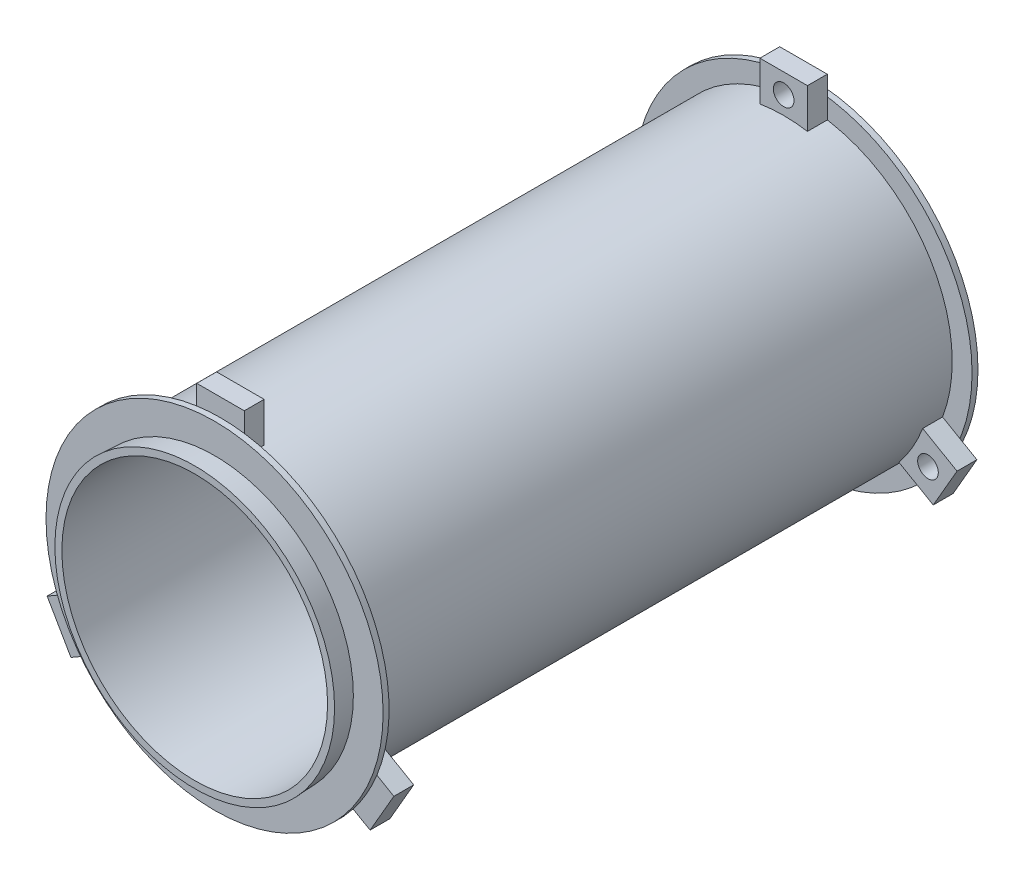
from build123d import *

# Parameters (mm, degrees)
SKETCH3_R                         = 75
MAIN_BODY_DEPTH                   = 300
SKETCH16_R                        = 70
EXTENSION_1_DEPTH                 = 10
EXTENSION_1_DRAFT                 = -3
SKETCH23_R                        = 67
CUT_EXTRUDE11_DEPTH               = 333
SKETCH35_W                        = 3
SKETCH35_H                        = 10
SKETCH37_W                        = 3
SKETCH37_H                        = 10
SKETCH46_R                        = 70
EXTENSION_2_DEPTH                 = 10
EXTENSION_2_DRAFT                 = 3
CUT_EXTRUDE16_DEPTH               = 34
CUT_EXTRUDE16_DEPTH_BACK          = 64
SKETCH47_R                        = 67
RODEHOLDER_DEPTH                  = 10
SKETCH55_R                        = 5.2
RODEHOLDERHOLE_DEPTH              = 8
RODEHOLDERPATTERN_COUNT           = 3
RODEHOLDERPATTERN_COPY_1_DEPTH    = 10
RODEHOLDERPATTERN_COPY_2_DEPTH    = 10
RODEHOLDERPATTERN_COPY_3_SKETCH_R = 5.2
RODEHOLDERPATTERN_COPY_3_DEPTH    = 8
RODEHOLDERPATTERN_COPY_4_SKETCH_R = 5.2
RODEHOLDERPATTERN_COPY_4_DEPTH    = 8


with BuildPart() as part:
    # Sketch3 → Main Body (new body)
    with BuildSketch(Plane.XY):
        Circle(SKETCH3_R)
    extrude(amount=MAIN_BODY_DEPTH)


with BuildPart() as extension_1_tool:
    # Sketch16 → Extension 1 (with draft: the straight prism first)
    with BuildSketch(Plane.XY.offset(300)):
        Circle(SKETCH16_R)
    extrude(amount=EXTENSION_1_DEPTH)
    # Extension 1: the draft: its side faces are tilted about the plane it starts from
    extension_1_sides = [extension_1_tool.faces().sort_by_distance(p)[0] for p in [
        (-70, 0, 305),
    ]]
    draft(extension_1_sides, Plane.XY.offset(300), EXTENSION_1_DRAFT)


with BuildPart() as part_1:
    add(part.part)

    # Extension 1: add extension_1_tool
    add(extension_1_tool.part)

    # Sketch23 → Cut-Extrude11 (cut)
    with BuildSketch(Plane.XY.offset(310)):
        Circle(SKETCH23_R)
    extrude(amount=-CUT_EXTRUDE11_DEPTH, mode=Mode.SUBTRACT)


with BuildPart() as body_2:
    # Sketch35 → Revolve7 (revolve)
    with BuildSketch(Plane(origin=(0, 0, 0), x_dir=(0, 0, -1), z_dir=(1, 0, 0)), mode=Mode.PRIVATE) as revolve7_sk:
        with Locations((-298.5, 80)):
            Rectangle(SKETCH35_W, SKETCH35_H)
    revolve(revolve7_sk.sketch.rotate(Axis((0, 0, -28.786578701), (0, 0, 1)), 90), axis=Axis((0, 0, -28.786578701), (0, 0, 1)))


with BuildPart() as body_3:
    # Sketch37 → Revolve11 (revolve)
    with BuildSketch(Plane(origin=(0, 0, 0), x_dir=(0, 0, -1), z_dir=(1, 0, 0)), mode=Mode.PRIVATE) as revolve11_sk:
        with Locations((-1.5, 80)):
            Rectangle(SKETCH37_W, SKETCH37_H)
    revolve(revolve11_sk.sketch.rotate(Axis((0, 0, 339.578392978), (0, 0, -1)), 90), axis=Axis((0, 0, 339.578392978), (0, 0, -1)))


with BuildPart() as extension_2_tool:
    # Sketch46 → Extension 2 (with draft: the straight prism first)
    with BuildSketch(Plane.XY):
        Circle(SKETCH46_R)
    extrude(amount=-EXTENSION_2_DEPTH)
    # Extension 2: the draft: its side faces are tilted about the plane it starts from
    extension_2_sides = [extension_2_tool.faces().sort_by_distance(p)[0] for p in [
        (-70, 0, -5),
    ]]
    draft(extension_2_sides, Plane.XY, EXTENSION_2_DRAFT)


with BuildPart() as part_2:
    add(part_1.part)

    # Extension 2: add extension_2_tool
    add(extension_2_tool.part)

    # Sketch47 → Cut-Extrude16 (cut, two sides: drawn at the far end of the back side and taken through both)
    with BuildSketch(Plane.XY.offset(-CUT_EXTRUDE16_DEPTH_BACK)):
        Circle(SKETCH47_R)
    extrude(amount=CUT_EXTRUDE16_DEPTH + CUT_EXTRUDE16_DEPTH_BACK, mode=Mode.SUBTRACT)


    add(body_2.part)  # RodeHolder merges body 2
    # Sketch49 → RodeHolder (add)
    with BuildSketch(Plane.XY.offset(297)):
        with BuildLine():
            ThreePointArc((-11.996756975, 74.030191347), (-6.017946224, 74.757153125), (0, 75.00000014))
            ThreePointArc((0, 75.00000014), (6.017946224, 74.757153125), (11.996756975, 74.030191347))
            Line((11.996756975, 74.030191347), (11.996756975, 94.030191347))
            Line((11.996756975, 94.030191347), (-11.996756975, 94.030191347))
            Line((-11.996756975, 94.030191347), (-11.996756975, 74.030191347))
        make_face()
    rodeholder = extrude(amount=-RODEHOLDER_DEPTH)

    # Sketch55 → RodeHolderHole (cut)
    with BuildSketch(Plane(origin=(0, 0, 287), x_dir=(-1, 0, 0), z_dir=(0, 0, -1))):
        with Locations((0, 84.032246503)):
            Circle(SKETCH55_R)
    rodeholderhole = extrude(amount=-RODEHOLDERHOLE_DEPTH, mode=Mode.SUBTRACT)

    # RodeHolderMirror: RodeHolder across plane
    add(rodeholder.mirror(Plane.XY.offset(150)))

    # RodeHolderMirror 2: RodeHolderHole across plane
    add(rodeholderhole.mirror(Plane.XY.offset(150)), mode=Mode.SUBTRACT)

    # RodeHolderPattern: RodeHolder, RodeHolderHole ×3 about axis
    rodeholderpattern_axis = Axis((0, 0, 0), (0, 0, 1))
    add([rodeholder.rotate(rodeholderpattern_axis, i * 360 / RODEHOLDERPATTERN_COUNT) for i in range(1, RODEHOLDERPATTERN_COUNT)])
    add([rodeholderhole.rotate(rodeholderpattern_axis, i * 360 / RODEHOLDERPATTERN_COUNT) for i in range(1, RODEHOLDERPATTERN_COUNT)], mode=Mode.SUBTRACT)

    # RodeHolderPattern copy 1 sketch → RodeHolderPattern copy 1 (add)
    with BuildSketch(Plane(origin=(0, 0, 3), x_dir=(-0.4999999999999998, 0.8660254037844387, 0), z_dir=(0, 0, -1))):
        with BuildLine():
            ThreePointArc((-11.996756975, -74.030191347), (-6.017946224, -74.757153125), (0, -75.00000014))
            ThreePointArc((0, -75.00000014), (6.017946224, -74.757153125), (11.996756975, -74.030191347))
            Line((11.996756975, -74.030191347), (11.996756975, -94.030191347))
            Line((11.996756975, -94.030191347), (-11.996756975, -94.030191347))
            Line((-11.996756975, -94.030191347), (-11.996756975, -74.030191347))
        make_face()
    extrude(amount=-RODEHOLDERPATTERN_COPY_1_DEPTH)

    # RodeHolderPattern copy 2 sketch → RodeHolderPattern copy 2 (add)
    with BuildSketch(Plane(origin=(0, 0, 3), x_dir=(-0.5000000000000004, -0.8660254037844384, 0), z_dir=(0, 0, -1))):
        with BuildLine():
            ThreePointArc((-11.996756975, -74.030191347), (-6.017946224, -74.757153125), (0, -75.00000014))
            ThreePointArc((0, -75.00000014), (6.017946224, -74.757153125), (11.996756975, -74.030191347))
            Line((11.996756975, -74.030191347), (11.996756975, -94.030191347))
            Line((11.996756975, -94.030191347), (-11.996756975, -94.030191347))
            Line((-11.996756975, -94.030191347), (-11.996756975, -74.030191347))
        make_face()
    extrude(amount=-RODEHOLDERPATTERN_COPY_2_DEPTH)

    # RodeHolderPattern copy 3 sketch → RodeHolderPattern copy 3 (cut)
    with BuildSketch(Plane(origin=(0, 0, 13), x_dir=(0.4999999999999998, -0.8660254037844387, 0), z_dir=(0, 0, 1))):
        with Locations((0, -84.032246503)):
            Circle(RODEHOLDERPATTERN_COPY_3_SKETCH_R)
    extrude(amount=-RODEHOLDERPATTERN_COPY_3_DEPTH, mode=Mode.SUBTRACT)

    # RodeHolderPattern copy 4 sketch → RodeHolderPattern copy 4 (cut)
    with BuildSketch(Plane(origin=(0, 0, 13), x_dir=(0.5000000000000004, 0.8660254037844384, 0), z_dir=(0, 0, 1))):
        with Locations((0, -84.032246503)):
            Circle(RODEHOLDERPATTERN_COPY_4_SKETCH_R)
    extrude(amount=-RODEHOLDERPATTERN_COPY_4_DEPTH, mode=Mode.SUBTRACT)


solid = Compound([body_3.part, part_2.part])
